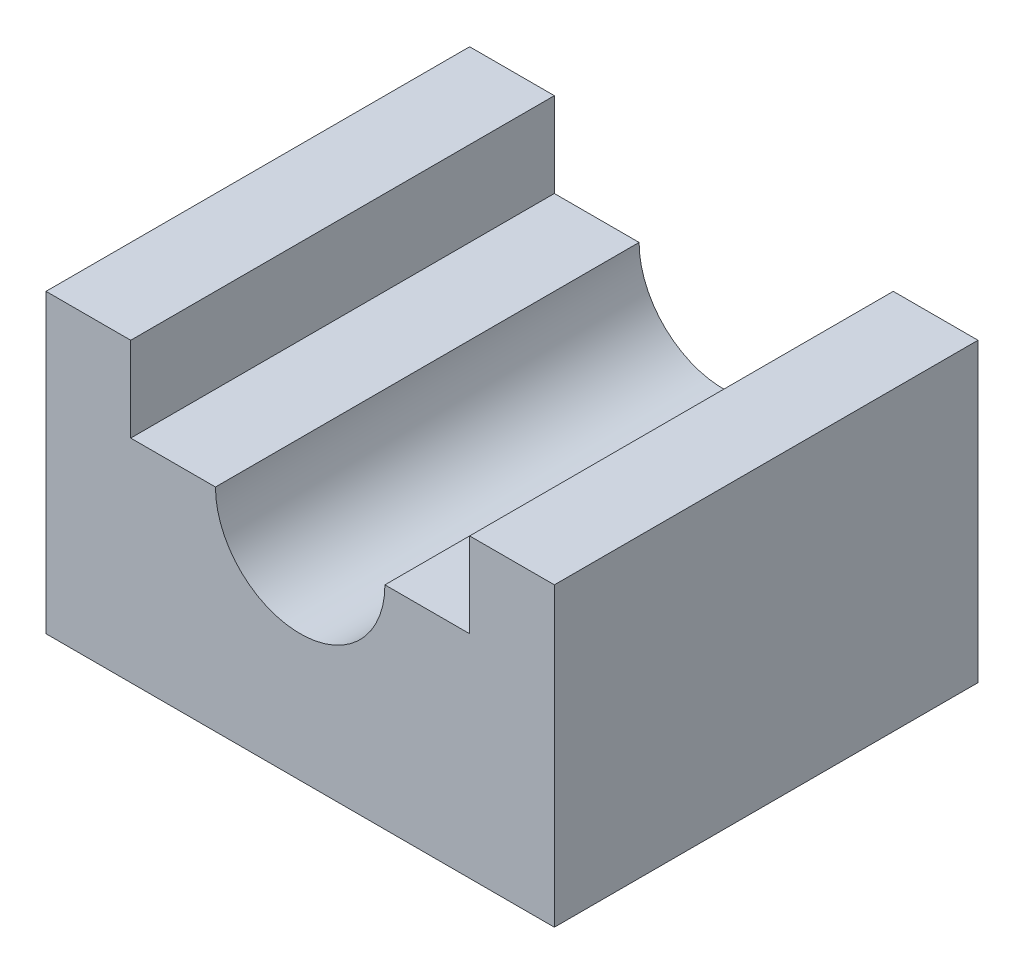
from build123d import *

# Parameters (mm, degrees)
BOSS_EXTRUDE1_DEPTH = 50


with BuildPart() as part:
    # Sketch1 → Boss-Extrude1 (new body)
    with BuildSketch(Plane.XY):
        with BuildLine():
            Line((-20, 35), (-20, 25))
            Line((-20, 25), (-10, 25))
            ThreePointArc((-10, 25), (0, 15), (10, 25))
            Line((10, 25), (20, 25))
            Line((20, 25), (20, 35))
            Line((20, 35), (30, 35))
            Line((30, 35), (30, 0))
            Line((30, 0), (-30, 0))
            Line((-30, 0), (-30, 35))
            Line((-30, 35), (-20, 35))
        make_face()
    extrude(amount=BOSS_EXTRUDE1_DEPTH)


solid = part.part
